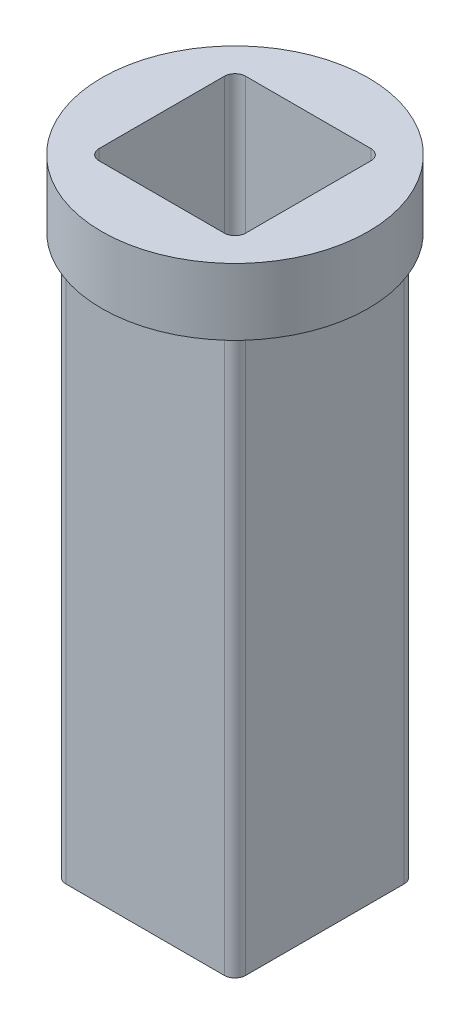
from build123d import *

# Parameters (mm, degrees)
SKETCH1_W           = 42.8625
SKETCH1_H           = 42.8625
BOSS_EXTRUDE1_DEPTH = 133.35
SKETCH2_R           = 31.75
BOSS_EXTRUDE2_DEPTH = 15.875
SKETCH3_W           = 34.925
SKETCH3_H           = 34.925
CUT_EXTRUDE1_DEPTH  = 146.05
FILLET1_R           = 2.54


with BuildPart() as part:
    # Sketch1 → Boss-Extrude1 (new body)
    with BuildSketch(Plane(origin=(0, 0, 0), x_dir=(1, 0, 0), z_dir=(0, 1, 0))):
        Rectangle(SKETCH1_W, SKETCH1_H)
    extrude(amount=BOSS_EXTRUDE1_DEPTH)

    # Sketch2 → Boss-Extrude2 (add)
    with BuildSketch(Plane(origin=(0, 133.35, 0), x_dir=(1, 0, 0), z_dir=(0, 1, 0))):
        with Locations(Location((0, 0, 0), (0, 0, 270))):
            Circle(SKETCH2_R)
    extrude(amount=BOSS_EXTRUDE2_DEPTH)

    # Sketch3 → Cut-Extrude1 (cut)
    with BuildSketch(Plane(origin=(0, 149.225, 0), x_dir=(1, 0, 0), z_dir=(0, 1, 0))):
        Rectangle(SKETCH3_W, SKETCH3_H)
    extrude(amount=-CUT_EXTRUDE1_DEPTH, mode=Mode.SUBTRACT)

    # Fillet1
    fillet1_edges = [part.edges().sort_by_distance(p)[0] for p in [
        (17.4625, 76.2, 17.4625),
        (17.4625, 76.2, -17.4625),
        (-17.4625, 76.2, -17.4625),
        (-17.4625, 76.2, 17.4625),
        (-21.43125, 66.675, -21.43125),
        (21.43125, 66.675, -21.43125),
        (21.43125, 66.675, 21.43125),
        (-21.43125, 66.675, 21.43125),
    ]]
    fillet(fillet1_edges, radius=FILLET1_R)


solid = part.part
